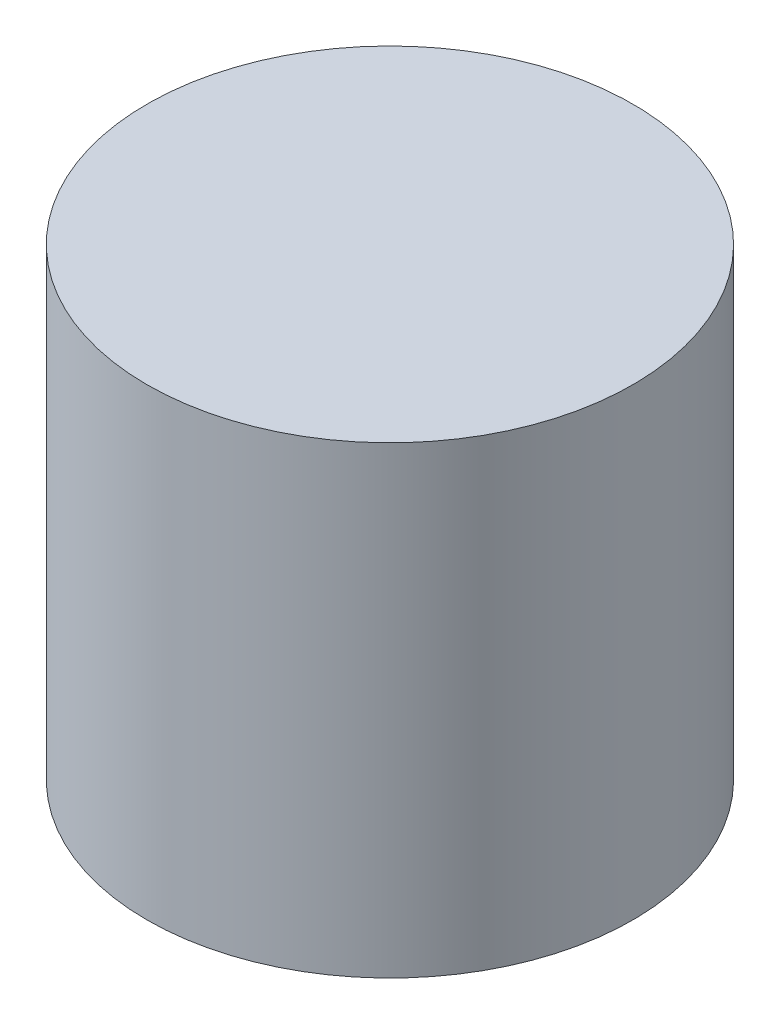
from build123d import *


with BuildPart() as part:
    # Croquis1 → Revolución1 (revolve)
    with BuildSketch(Plane(origin=(0, 0, 0), x_dir=(0, 0, -1), z_dir=(1, 0, 0))):
        Polygon((0, 45), (-260, 45), (-260, -451), (-56, -451), (-56, -551), (0, -551), align=None)
    revolve(axis=Axis((0, 45, 0), (0, -1, 0)))


solid = part.part
